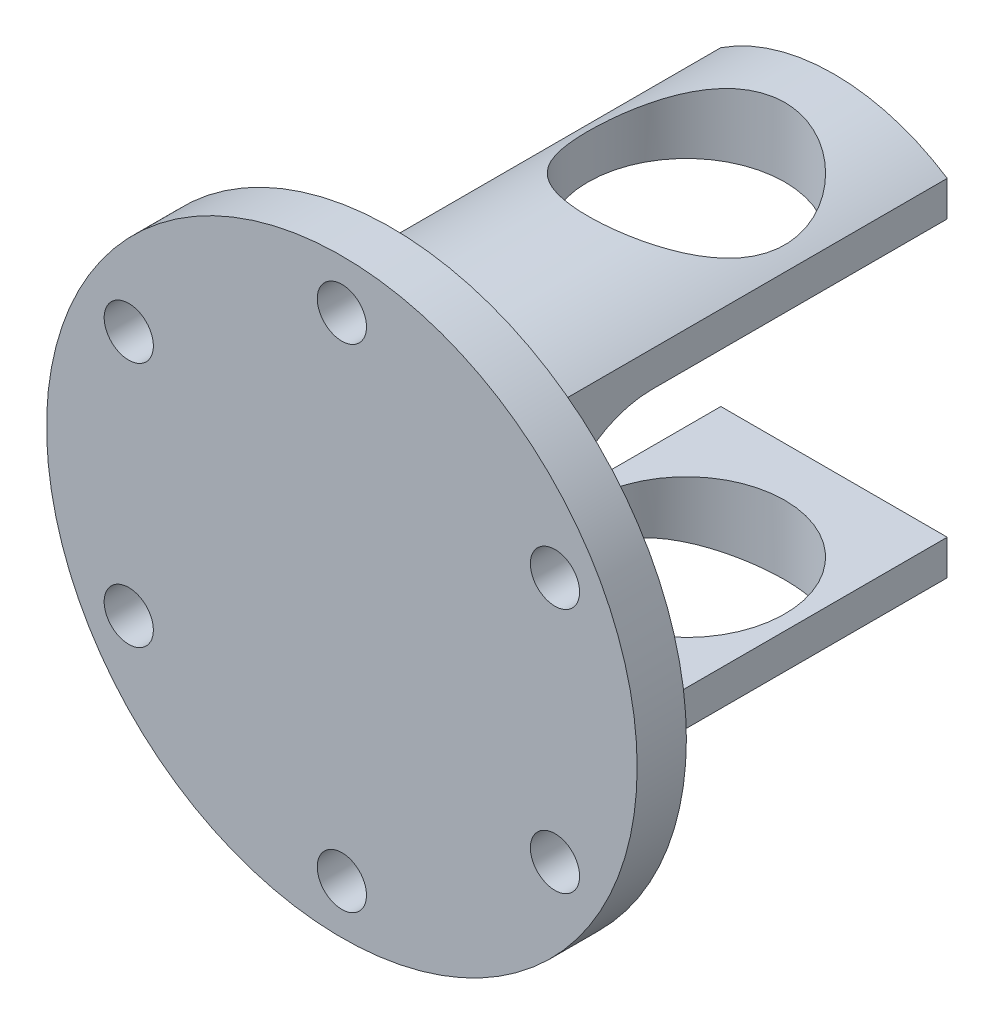
from build123d import *
from build123d.topology import SkipClean

# Parameters (mm, degrees)
SZKIC1_R                               = 21
DODANIE_WYCI_GNI_CIE1_DEPTH            = 5
DODANIE_WYCI_GNI_CIE2_START            = 40
DODANIE_WYCI_GNI_CIE2_DEPTH            = 40
WYTNIJ_WYCI_GNI_CIE1_REACH             = 59.149
SZKIC4_R                               = 10
WYTNIJ_WYCI_GNI_CIE1_DIRECTION_2_DEPTH = 58.148928249
ZAOKR_GLENIE1_R                        = 10
SZKIC6_R                               = 30
DODANIE_WYCI_GNI_CIE3_DEPTH            = 5
SZKIC7_R                               = 2.5
WYTNIJ_WYCI_GNI_CIE2_DEPTH             = 5
SZYK_KO_OWY1_COUNT                     = 6


with BuildPart() as part:
    # Szkic1 → Dodanie-wyciągnięcie1 (new body)
    with BuildSketch(Plane.XY):
        Circle(SZKIC1_R)
    extrude(amount=DODANIE_WYCI_GNI_CIE1_DEPTH)

    # Szkic2 → Dodanie-wyciągnięcie2 (add)
    with SkipClean():  # the faces are left unmerged after this step: merging them gives an invalid solid
        with BuildSketch(Plane(origin=(0, 0, 0), x_dir=(-1, 0, 0), z_dir=(0, 0, -1)).offset(DODANIE_WYCI_GNI_CIE2_START)):
            with BuildLine():
                Line((-11.5, 17.571283391), (-11.5, 14))
                Line((-11.5, 14), (11.5, 14))
                Line((11.5, 14), (11.5, 17.571283391))
                ThreePointArc((11.5, 17.571283391), (0, 21), (-11.5, 17.571283391))
            make_face()
            with BuildLine():
                Line((11.5, -14), (11.5, -17.571283391))
                ThreePointArc((11.5, -17.571283391), (0, -21), (-11.5, -17.571283391))
                Line((-11.5, -17.571283391), (-11.5, -14))
                Line((-11.5, -14), (11.5, -14))
            make_face()
        extrude(amount=-DODANIE_WYCI_GNI_CIE2_DEPTH)

    # Szkic4 → Wytnij-wyciągnięcie1 (cut, up to next)
    with BuildSketch(Plane(origin=(0, -14, 0), x_dir=(1, 0, 0), z_dir=(0, 1, 0)), mode=Mode.PRIVATE) as wytnij_wyci_gni_cie1_sk1:
        with Locations(Location((0, 25, 0), (0, 0, 90))):
            Circle(SZKIC4_R)
    wytnij_wyci_gni_cie1_tool1 = extrude(wytnij_wyci_gni_cie1_sk1.sketch, amount=-WYTNIJ_WYCI_GNI_CIE1_REACH, mode=Mode.PRIVATE) & part.part
    add(wytnij_wyci_gni_cie1_tool1.solids().sort_by_distance((0, -14, -25))[0], mode=Mode.SUBTRACT)

    # Szkic4 → Wytnij-wyciągnięcie1 direction 2 (cut)
    with SkipClean():  # the faces are left unmerged after this step: merging them gives an invalid solid
        with BuildSketch(Plane(origin=(0, -14, 0), x_dir=(1, 0, 0), z_dir=(0, 1, 0))):
            with Locations(Location((0, 25, 0), (0, 0, 90))):
                Circle(SZKIC4_R)
        extrude(amount=WYTNIJ_WYCI_GNI_CIE1_DIRECTION_2_DEPTH, mode=Mode.SUBTRACT)

    # Zaokrąglenie1
    zaokr_glenie1_edges = [part.edges().sort_by_distance(p)[0] for p in [
        (0, -14, 0),
        (0, 14, 0),
    ]]
    fillet(zaokr_glenie1_edges, radius=ZAOKR_GLENIE1_R)

    # Szkic6 → Dodanie-wyciągnięcie3 (add)
    with SkipClean():  # the faces are left unmerged after this step: merging them gives an invalid solid
        with BuildSketch(Plane.XY.offset(5)):
            Circle(SZKIC6_R)
        extrude(amount=DODANIE_WYCI_GNI_CIE3_DEPTH)

    # Szkic7 → Wytnij-wyciągnięcie2 (cut)
    with SkipClean():  # the faces are left unmerged after this step: merging them gives an invalid solid
        with BuildSketch(Plane.XY.offset(10)):
            with Locations((0, 25)):
                Circle(SZKIC7_R)
        wytnij_wyci_gni_cie2 = extrude(amount=-WYTNIJ_WYCI_GNI_CIE2_DEPTH, mode=Mode.SUBTRACT)

    # Szyk kołowy1: Wytnij-wyciągnięcie2 ×6 about axis
    with SkipClean():  # the faces are left unmerged after this step: merging them gives an invalid solid
        szyk_ko_owy1_axis = Axis((0, 0, 0), (0, 0, 1))
        for i in range(1, SZYK_KO_OWY1_COUNT):
            add(wytnij_wyci_gni_cie2.rotate(szyk_ko_owy1_axis, i * 360 / SZYK_KO_OWY1_COUNT), mode=Mode.SUBTRACT)


solid = part.part
